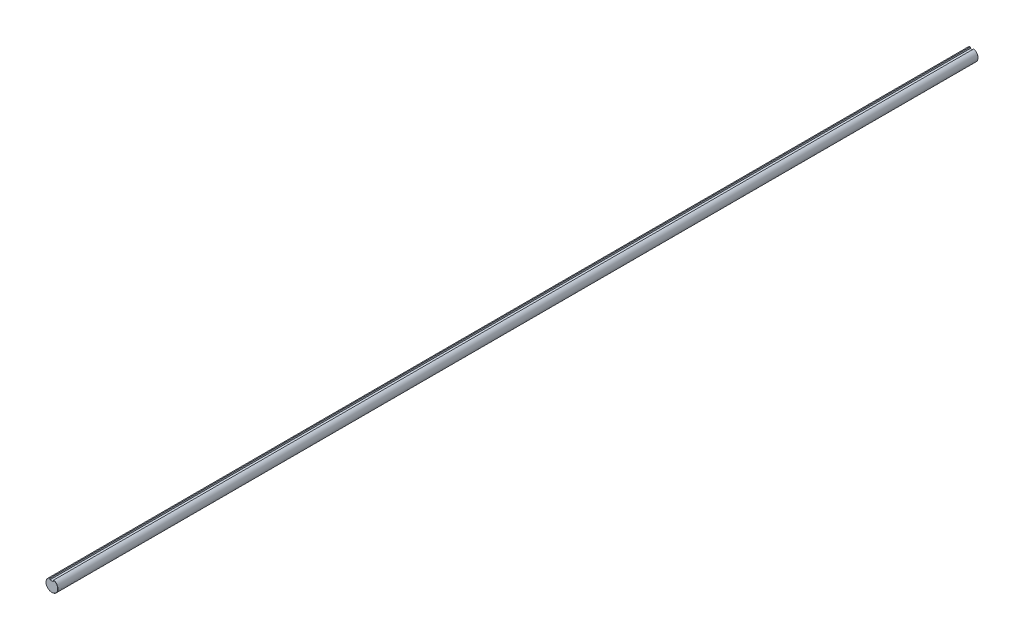
from build123d import *

# Parameters (mm, degrees)
BOSS_EXTRUDE1_DEPTH      = 304.8
BOSS_EXTRUDE1_DEPTH_BACK = 304.8
CHAMFER1_SIZE            = 0.079375


with BuildPart() as part:
    # Sketch3 → Boss-Extrude1 (new, two sides: drawn at the far end of the back side and taken through both)
    with BuildSketch(Plane.XY.offset(-BOSS_EXTRUDE1_DEPTH_BACK)):
        with BuildLine():
            Line((-1.1938, 2.77495), (-1.1938, 3.784946251))
            ThreePointArc((-1.1938, 3.784946251), (0, -3.96875), (1.1938, 3.784946251))
            Line((1.1938, 3.784946251), (1.1938, 2.77495))
            Line((1.1938, 2.77495), (-1.1938, 2.77495))
        make_face()
    extrude(amount=BOSS_EXTRUDE1_DEPTH + BOSS_EXTRUDE1_DEPTH_BACK)

    # Chamfer1
    chamfer1_edges = [part.edges().sort_by_distance(p)[0] for p in [
        (0, -3.96875, -304.8),
        (0, -3.96875, 304.8),
    ]]
    chamfer(chamfer1_edges, length=CHAMFER1_SIZE)


solid = part.part
